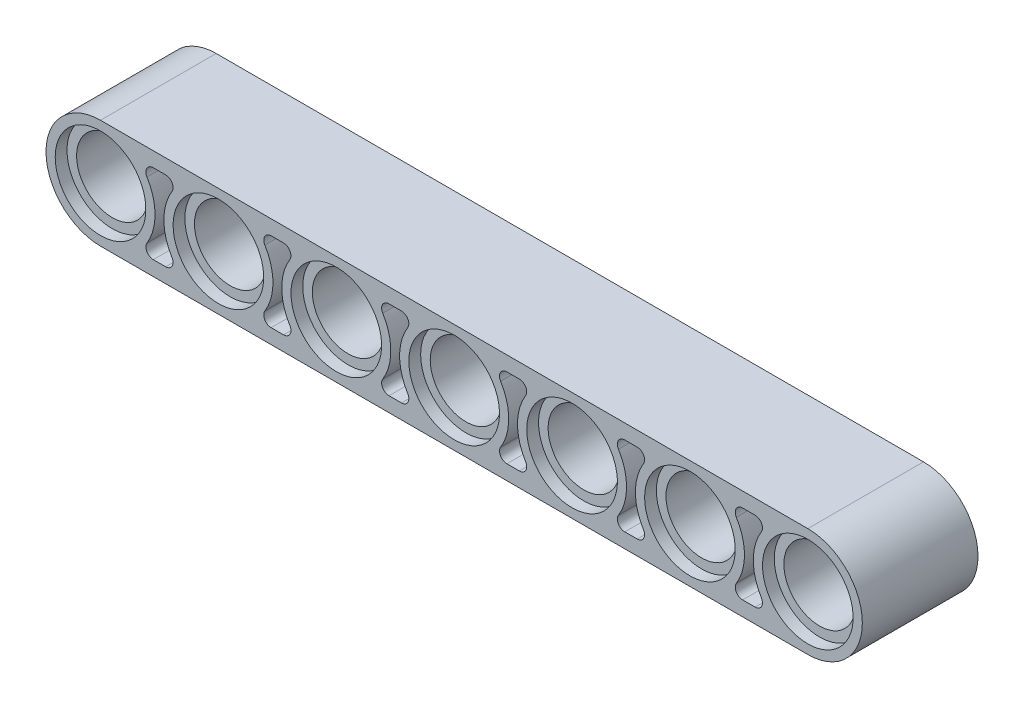
from build123d import *

# Parameters (mm, degrees)
BOSS_EXTRUDE1_DEPTH = 7.85
BOSS_EXTRUDE2_DEPTH = 0.6
LPATTERN1_COUNT     = 7
LPATTERN1_PITCH     = 8
CUT_EXTRUDE1_DEPTH  = 53.423301117


with BuildPart() as part:
    # Sketch1 → Revolve1 (revolve)
    with BuildSketch(Plane(origin=(0, 0, 0), x_dir=(1, 0, 0), z_dir=(0, 1, 0))):
        Polygon((-3.7, 3.925), (-3.7, -3.925), (-3.075, -3.925), (-3.075, -3.125), (-2.425, -3.125), (-2.425, 3.125), (-3.075, 3.125), (-3.075, 3.925), align=None)
    revolve1 = revolve(axis=Axis((0, 0, -2.425), (0, 0, 1)))

    # Sketch2 → Boss-Extrude1 (add)
    with BuildSketch(Plane.XY.offset(3.925)):
        with BuildLine():
            Line((0, 3.7), (-8, 3.7))
            Line((-8, 3.7), (-8, 3.2))
            ThreePointArc((-8, 3.2), (-4.8, 0), (-8, -3.2))
            Line((-8, -3.2), (-8, -3.7))
            Line((-8, -3.7), (0, -3.7))
            Line((0, -3.7), (0, -3.2))
            ThreePointArc((0, -3.2), (-3.2, 0), (0, 3.2))
            Line((0, 3.2), (0, 3.7))
        make_face()
        with BuildLine():
            Line((-3.577708764, -2.7), (-4.422291236, -2.7))
            ThreePointArc((-4.422291236, -2.7), (-4.858727016, -2.443975018), (-4.848208946, -1.938095238))
            ThreePointArc((-4.848208946, -1.938095238), (-4.3, 0), (-4.848208946, 1.938095238))
            ThreePointArc((-4.848208946, 1.938095238), (-4.858727016, 2.443975018), (-4.422291236, 2.7))
            Line((-4.422291236, 2.7), (-3.577708764, 2.7))
            ThreePointArc((-3.577708764, 2.7), (-3.141272984, 2.443975018), (-3.151791054, 1.938095238))
            ThreePointArc((-3.151791054, 1.938095238), (-3.7, 0), (-3.151791054, -1.938095238))
            ThreePointArc((-3.151791054, -1.938095238), (-3.141272984, -2.443975018), (-3.577708764, -2.7))
        make_face(mode=Mode.SUBTRACT)
    boss_extrude1 = extrude(amount=-BOSS_EXTRUDE1_DEPTH)

    # Sketch3 → Boss-Extrude2 (add, symmetric)
    with BuildSketch(Plane.XY):
        with BuildLine():
            Line((-3.577708764, 2.7), (-4.422291236, 2.7))
            ThreePointArc((-4.422291236, 2.7), (-4.858727016, 2.443975018), (-4.848208946, 1.938095238))
            ThreePointArc((-4.848208946, 1.938095238), (-4.3, 0), (-4.848208946, -1.938095238))
            ThreePointArc((-4.848208946, -1.938095238), (-4.858727016, -2.443975018), (-4.422291236, -2.7))
            Line((-4.422291236, -2.7), (-3.577708764, -2.7))
            ThreePointArc((-3.577708764, -2.7), (-3.141272984, -2.443975018), (-3.151791054, -1.938095238))
            ThreePointArc((-3.151791054, -1.938095238), (-3.7, 0), (-3.151791054, 1.938095238))
            ThreePointArc((-3.151791054, 1.938095238), (-3.141272984, 2.443975018), (-3.577708764, 2.7))
        make_face()
    boss_extrude2 = extrude(amount=BOSS_EXTRUDE2_DEPTH, both=True)

    # LPattern1: Revolve1, Boss-Extrude1, Boss-Extrude2 ×7
    with Locations(*[(i * LPATTERN1_PITCH, 0, 0) for i in range(1, LPATTERN1_COUNT)]):
        add(revolve1)
        add(boss_extrude1)
        add(boss_extrude2)

    # Sketch4 → Cut-Extrude1 (cut, through all)
    with BuildSketch(Plane.XY.offset(3.925)):
        with BuildLine():
            Line((0, 3.7), (-8, 3.7))
            Line((-8, 3.7), (-8, -3.7))
            Line((-8, -3.7), (0, -3.7))
            ThreePointArc((0, -3.7), (-3.7, 0), (0, 3.7))
        make_face()
    extrude(amount=-CUT_EXTRUDE1_DEPTH, mode=Mode.SUBTRACT)


solid = part.part
